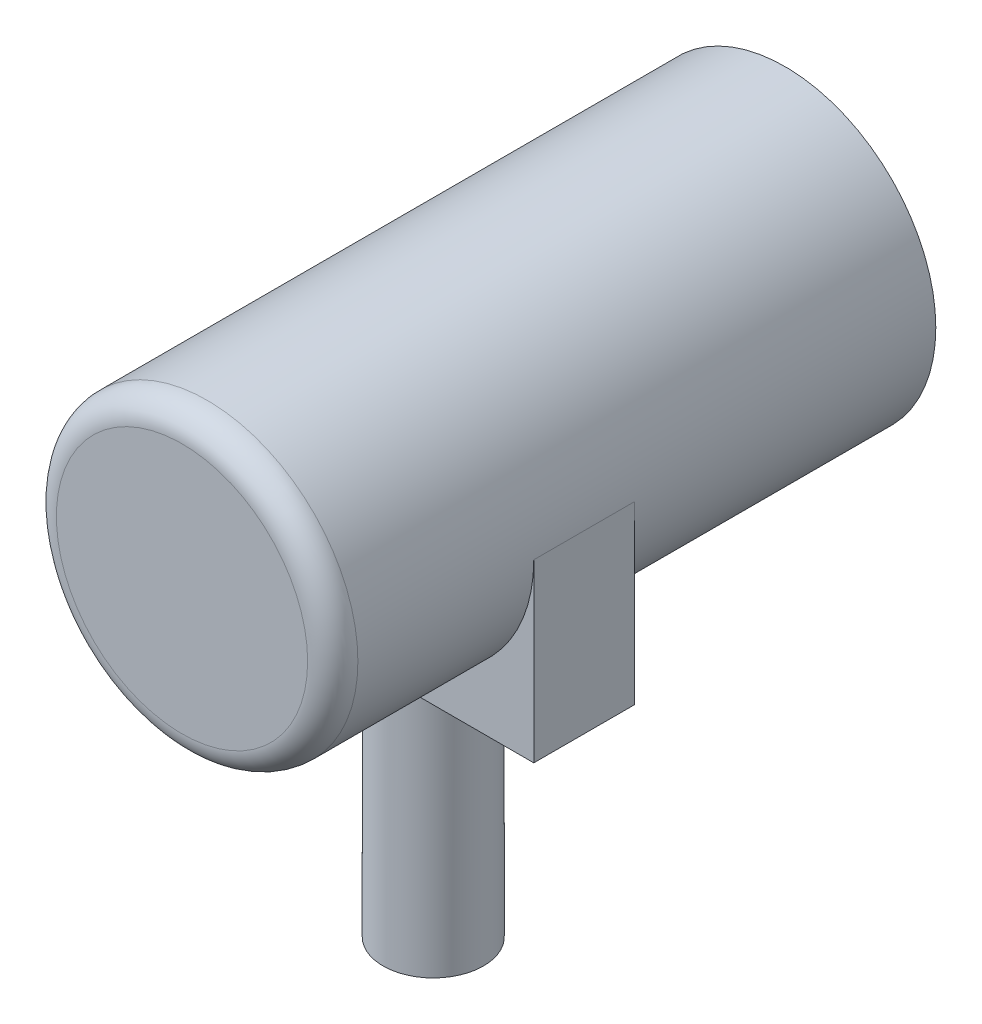
from build123d import *

# Parameters (mm, degrees)
TUBE_SKETCH_R             = 30
TUBE_EXTRUDE_DEPTH        = 120
TUBE_SHELL_T              = -5
SUPPRT_START              = 20
SUPPRT_BAND_EXTRUDE_DEPTH = 20
PIN_SKETCH_R              = 10
PIN_EXTRUDE_DEPTH         = 50
APERTURE_START            = -4
APERTURE_SKETCH_R         = 25
APERTURE_EXTRUDE_DEPTH    = 2
REAR_FILLET_R             = 5


with BuildPart() as part:
    # Tube Sketch → Tube Extrude (new body)
    with BuildSketch(Plane.XY):
        Circle(TUBE_SKETCH_R)
    extrude(amount=-TUBE_EXTRUDE_DEPTH)

    # Tube Shell
    tube_shell_openings = [part.faces().sort_by_distance(p)[0] for p in [
        (0, 0, -120),
    ]]
    offset(amount=TUBE_SHELL_T, openings=tube_shell_openings, kind=Kind.INTERSECTION)

    # Support Band Sketch → Supprt Band Extrude (add)
    with BuildSketch(Plane.XY.offset(-60).offset(SUPPRT_START)):
        with BuildLine():
            Line((-30, 0), (-30, -35))
            Line((-30, -35), (30, -35))
            Line((30, -35), (30, 0))
            ThreePointArc((30, 0), (0, -30), (-30, 0))
        make_face()
    extrude(amount=-SUPPRT_BAND_EXTRUDE_DEPTH)

    # Pin Sketch → Pin Extrude (add)
    with BuildSketch(Plane.XZ.offset(35)):
        with Locations(Location((0, -50, 0), (0, 0, 270))):
            Circle(PIN_SKETCH_R)
    extrude(amount=PIN_EXTRUDE_DEPTH)

    # Aperture Sketch → Aperture Extrude (add)
    with BuildSketch(Plane(origin=(0, 0, -120), x_dir=(-1, 0, 0), z_dir=(0, 0, -1)).offset(APERTURE_START)):
        with Locations(Location((0, 0, 0), (0, 0, 180))):
            Circle(APERTURE_SKETCH_R)
    extrude(amount=APERTURE_EXTRUDE_DEPTH)

    # Rear Fillet
    rear_fillet_edges = [part.edges().sort_by_distance(p)[0] for p in [
        (-30, 0, 0),
    ]]
    fillet(rear_fillet_edges, radius=REAR_FILLET_R)


solid = part.part
